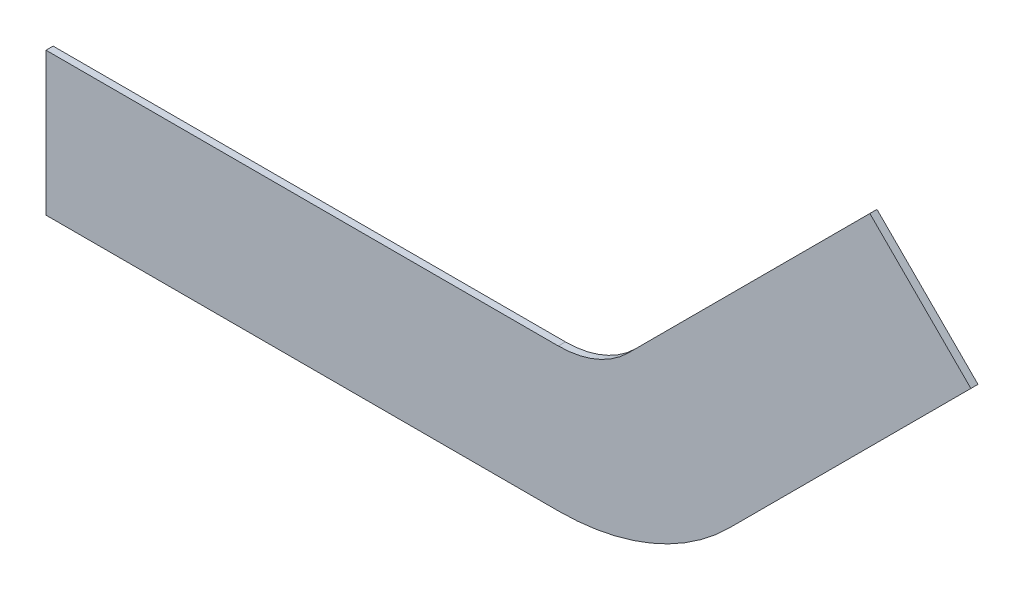
from build123d import *

# Parameters (mm, degrees)
BASE_EXTRUDE_DEPTH = 3.175


with BuildPart() as part:
    # Sketch1 → Base Extrude (new body)
    with BuildSketch(Plane.XY):
        with BuildLine():
            Line((0, 0), (0, -63.754))
            Line((0, -63.754), (228.6, -63.754))
            ThreePointArc((228.6, -63.754), (269.910676524, -55.536795535), (304.932177029, -32.136177029))
            Line((304.932177029, -32.136177029), (412.695250482, 75.626896424))
            Line((412.695250482, 75.626896424), (367.614364754, 120.707782152))
            Line((367.614364754, 120.707782152), (259.851291301, 12.944708699))
            ThreePointArc((259.851291301, 12.944708699), (245.513076977, 3.364220181), (228.6, 0))
            Line((228.6, 0), (0, 0))
        make_face()
    extrude(amount=BASE_EXTRUDE_DEPTH)


solid = part.part
